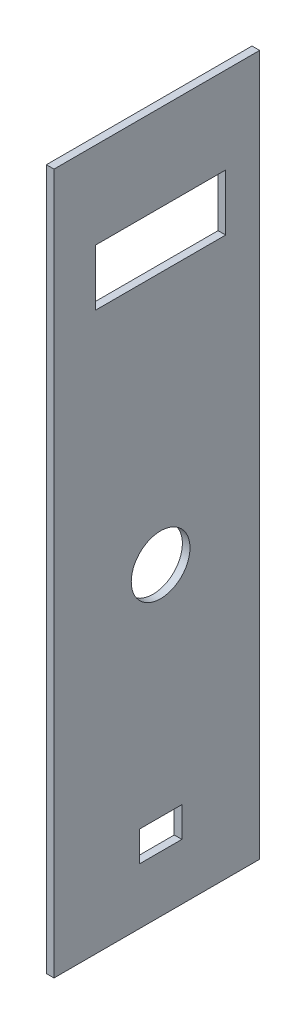
from build123d import *

# Parameters (mm, degrees)
SKETCH1_W           = 82.55
SKETCH1_H           = 292.1
BOSS_EXTRUDE1_DEPTH = 3.175
CUT_EXTRUDE1_REACH  = 305.557
SKETCH2_W           = 50.25
SKETCH2_H           = 19.5
CUT_EXTRUDE2_REACH  = 305.557
SKETCH4_R           = 10.25
CUT_EXTRUDE3_REACH  = 305.557
SKETCH5_W           = 13.7
SKETCH5_H           = 8.55
CUT_EXTRUDE4_REACH  = 305.557
SKETCH6_R           = 12.25
SKETCH6_R_2         = 10.25
SKETCH6_W           = 54.25
SKETCH6_H           = 23.5
SKETCH6_W_2         = 50.25
SKETCH6_H_2         = 19.5
SKETCH6_W_3         = 17.7
SKETCH6_H_3         = 12.55
SKETCH6_W_4         = 13.7
SKETCH6_H_4         = 8.55
SKETCH7_W           = 3.175
SKETCH7_H           = 292.1
BOSS_EXTRUDE2_DEPTH = 3.175


with BuildPart() as part:
    # Sketch1 → Boss-Extrude1 (new body)
    with BuildSketch(Plane(origin=(0, 0, 0), x_dir=(0, 0, -1), z_dir=(1, 0, 0))):
        with Locations((41.275, 146.05)):
            Rectangle(SKETCH1_W, SKETCH1_H)
    extrude(amount=BOSS_EXTRUDE1_DEPTH)

    # Sketch2 → Cut-Extrude1 (cut, up to next)
    with BuildSketch(Plane.ZY, mode=Mode.PRIVATE) as cut_extrude1_sk1:
        with Locations((-41.275, 244.25)):
            Rectangle(SKETCH2_W, SKETCH2_H)
    cut_extrude1_tool1 = extrude(cut_extrude1_sk1.sketch, amount=-CUT_EXTRUDE1_REACH, mode=Mode.PRIVATE) & part.part
    add(cut_extrude1_tool1.solids().sort_by_distance((0, 244.25, -41.275))[0], mode=Mode.SUBTRACT)

    # Sketch4 → Cut-Extrude2 (cut, up to next)
    with BuildSketch(Plane.ZY, mode=Mode.PRIVATE) as cut_extrude2_sk1:
        with Locations((-41.275, 127)):
            Circle(SKETCH4_R)
    cut_extrude2_tool1 = extrude(cut_extrude2_sk1.sketch, amount=-CUT_EXTRUDE2_REACH, mode=Mode.PRIVATE) & part.part
    add(cut_extrude2_tool1.solids().sort_by_distance((0, 127, -41.275))[0], mode=Mode.SUBTRACT)

    # Sketch5 → Cut-Extrude3 (cut, up to next)
    with BuildSketch(Plane.ZY, mode=Mode.PRIVATE) as cut_extrude3_sk1:
        with Locations((-41.275, 29.675)):
            Rectangle(SKETCH5_W, SKETCH5_H)
    cut_extrude3_tool1 = extrude(cut_extrude3_sk1.sketch, amount=-CUT_EXTRUDE3_REACH, mode=Mode.PRIVATE) & part.part
    add(cut_extrude3_tool1.solids().sort_by_distance((0, 29.675, -41.275))[0], mode=Mode.SUBTRACT)

    # Sketch6 → Cut-Extrude4 (cut, up to next)
    with BuildSketch(Plane.ZY, mode=Mode.PRIVATE) as cut_extrude4_sk1:
        with Locations((-41.275, 127)):
            Circle(SKETCH6_R)
        with Locations((-41.275, 127)):
            Circle(SKETCH6_R_2, mode=Mode.SUBTRACT)
    cut_extrude4_tool1 = extrude(cut_extrude4_sk1.sketch, amount=-CUT_EXTRUDE4_REACH, mode=Mode.PRIVATE) & part.part
    # Sketch6 → Cut-Extrude4 (cut, up to next)
    with BuildSketch(Plane.ZY, mode=Mode.PRIVATE) as cut_extrude4_sk2:
        with Locations((-41.275, 244.25)):
            Rectangle(SKETCH6_W, SKETCH6_H)
        with Locations((-41.275, 244.25)):
            Rectangle(SKETCH6_W_2, SKETCH6_H_2, mode=Mode.SUBTRACT)
    cut_extrude4_tool2 = extrude(cut_extrude4_sk2.sketch, amount=-CUT_EXTRUDE4_REACH, mode=Mode.PRIVATE) & part.part
    # Sketch6 → Cut-Extrude4 (cut, up to next)
    with BuildSketch(Plane.ZY, mode=Mode.PRIVATE) as cut_extrude4_sk3:
        with Locations((-41.275, 29.675)):
            Rectangle(SKETCH6_W_3, SKETCH6_H_3)
        with Locations((-41.275, 29.675)):
            Rectangle(SKETCH6_W_4, SKETCH6_H_4, mode=Mode.SUBTRACT)
    cut_extrude4_tool3 = extrude(cut_extrude4_sk3.sketch, amount=-CUT_EXTRUDE4_REACH, mode=Mode.PRIVATE) & part.part
    add(cut_extrude4_tool1.solids().sort_by_distance((0, 127, -53.178518))[0], mode=Mode.SUBTRACT)
    add(cut_extrude4_tool2.solids().sort_by_distance((0, 255.408788, -41.275))[0], mode=Mode.SUBTRACT)
    add(cut_extrude4_tool3.solids().sort_by_distance((0, 35.733022, -41.275))[0], mode=Mode.SUBTRACT)


with BuildPart() as body_2:
    # Sketch7 → Boss-Extrude2 (new body)
    with BuildSketch(Plane(origin=(3.175, 0, 0), x_dir=(0, 0, -1), z_dir=(1, 0, 0))):
        with Locations((-1.5875, 146.05)):
            Rectangle(SKETCH7_W, SKETCH7_H)
    extrude(amount=-BOSS_EXTRUDE2_DEPTH)


with BuildPart() as part_1:
    add(part.part)

    # Combine1: union body 2
    add(body_2.part)


solid = part_1.part
